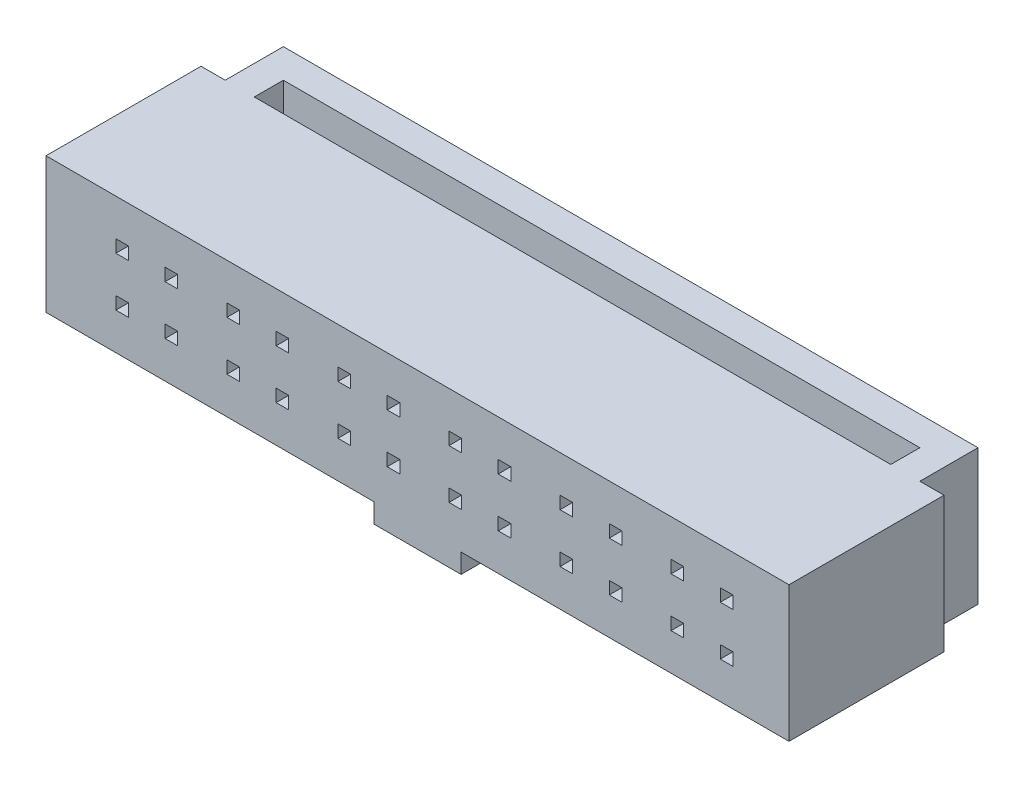
from build123d import *

# Parameters (mm, degrees)
SKETCH1_W           = 0.65
SKETCH1_H           = 0.65
BOSS_EXTRUDE1_DEPTH = 8
BOSS_EXTRUDE2_DEPTH = 7


with BuildPart() as part:
    # Sketch1 → Boss-Extrude1 (new body)
    with BuildSketch(Plane.XY):
        Polygon((2.182384268, 30.912610308), (19.102384268, 30.912610308), (19.102384268, 29.912610308), (23.602384268, 29.912610308), (23.602384268, 30.912610308), (40.522384268, 30.912610308), (40.522384268, 37.912610308), (2.182384268, 37.912610308), align=None)
        with Locations((6.112384268, 33.142610308)):
            Rectangle(SKETCH1_W, SKETCH1_H, mode=Mode.SUBTRACT)
        with Locations((8.652384268, 33.142610308)):
            Rectangle(SKETCH1_W, SKETCH1_H, mode=Mode.SUBTRACT)
        with Locations((6.112384268, 35.682610308)):
            Rectangle(SKETCH1_W, SKETCH1_H, mode=Mode.SUBTRACT)
        with Locations((8.652384268, 35.682610308)):
            Rectangle(SKETCH1_W, SKETCH1_H, mode=Mode.SUBTRACT)
        with Locations((14.382384268, 33.142610308)):
            Rectangle(SKETCH1_W, SKETCH1_H, mode=Mode.SUBTRACT)
        with Locations((11.842384268, 35.682610308)):
            Rectangle(SKETCH1_W, SKETCH1_H, mode=Mode.SUBTRACT)
        with Locations((11.842384268, 33.142610308)):
            Rectangle(SKETCH1_W, SKETCH1_H, mode=Mode.SUBTRACT)
        with Locations((14.382384268, 35.682610308)):
            Rectangle(SKETCH1_W, SKETCH1_H, mode=Mode.SUBTRACT)
        with Locations((20.112384268, 33.142610308)):
            Rectangle(SKETCH1_W, SKETCH1_H, mode=Mode.SUBTRACT)
        with Locations((17.572384268, 35.682610308)):
            Rectangle(SKETCH1_W, SKETCH1_H, mode=Mode.SUBTRACT)
        with Locations((17.572384268, 33.142610308)):
            Rectangle(SKETCH1_W, SKETCH1_H, mode=Mode.SUBTRACT)
        with Locations((20.112384268, 35.682610308)):
            Rectangle(SKETCH1_W, SKETCH1_H, mode=Mode.SUBTRACT)
        with Locations((25.842384268, 33.142610308)):
            Rectangle(SKETCH1_W, SKETCH1_H, mode=Mode.SUBTRACT)
        with Locations((23.302384268, 35.682610308)):
            Rectangle(SKETCH1_W, SKETCH1_H, mode=Mode.SUBTRACT)
        with Locations((23.302384268, 33.142610308)):
            Rectangle(SKETCH1_W, SKETCH1_H, mode=Mode.SUBTRACT)
        with Locations((25.842384268, 35.682610308)):
            Rectangle(SKETCH1_W, SKETCH1_H, mode=Mode.SUBTRACT)
        with Locations((31.572384268, 33.142610308)):
            Rectangle(SKETCH1_W, SKETCH1_H, mode=Mode.SUBTRACT)
        with Locations((29.032384268, 35.682610308)):
            Rectangle(SKETCH1_W, SKETCH1_H, mode=Mode.SUBTRACT)
        with Locations((29.032384268, 33.142610308)):
            Rectangle(SKETCH1_W, SKETCH1_H, mode=Mode.SUBTRACT)
        with Locations((31.572384268, 35.682610308)):
            Rectangle(SKETCH1_W, SKETCH1_H, mode=Mode.SUBTRACT)
        with Locations((37.302384268, 33.142610308)):
            Rectangle(SKETCH1_W, SKETCH1_H, mode=Mode.SUBTRACT)
        with Locations((34.762384268, 35.682610308)):
            Rectangle(SKETCH1_W, SKETCH1_H, mode=Mode.SUBTRACT)
        with Locations((34.762384268, 33.142610308)):
            Rectangle(SKETCH1_W, SKETCH1_H, mode=Mode.SUBTRACT)
        with Locations((37.302384268, 35.682610308)):
            Rectangle(SKETCH1_W, SKETCH1_H, mode=Mode.SUBTRACT)
    extrude(amount=BOSS_EXTRUDE1_DEPTH)

    # Sketch2 → Boss-Extrude2 (add)
    with BuildSketch(Plane(origin=(0, 37.912610308, 0), x_dir=(1, 0, 0), z_dir=(0, 1, 0))):
        Polygon((3.429740031, 0), (3.429740031, 3), (39.275028505, 3), (39.275028505, 0), (37.775028505, 0), (37.775028505, 1.5), (4.929740031, 1.5), (4.929740031, 0), align=None)
    extrude(amount=-BOSS_EXTRUDE2_DEPTH)


solid = part.part
